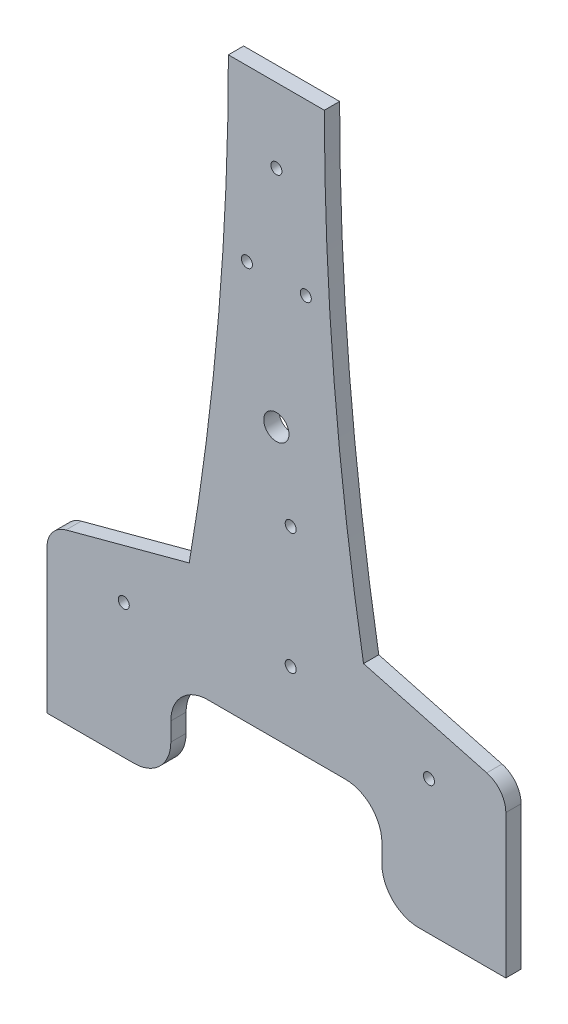
from build123d import *

# Parameters (mm, degrees)
ESBO_O2_R                = 1.5
ESBO_O2_R_2              = 3.425
RESSALTO_EXTRUS_O1_DEPTH = 4.15


with BuildPart() as part:
    # Esboço2 → Ressalto-extrusão1 (new body)
    with BuildSketch(Plane.XY):
        with BuildLine():
            Line((0, 0), (23.7, 0))
            ThreePointArc((23.7, 0), (30.771067812, 2.928932188), (33.7, 10))
            Line((33.7, 10), (33.7, 15))
            ThreePointArc((33.7, 15), (36.628932188, 22.071067812), (43.7, 25))
            Line((43.7, 25), (81.1, 25))
            ThreePointArc((81.1, 25), (88.171067812, 22.071067812), (91.1, 15))
            Line((91.1, 15), (91.1, 10))
            ThreePointArc((91.1, 10), (94.028932188, 2.928932188), (101.1, 0))
            Line((101.1, 0), (124.8, 0))
            Line((124.8, 0), (124.8, 38.959077337))
            ThreePointArc((124.8, 38.959077337), (123.353473382, 43.22040734), (119.611733316, 45.720558121))
            Line((119.611733316, 45.720558121), (86.1, 54.7))
            ThreePointArc((86.1, 54.7), (78.117314341, 116.973565182), (75.45, 179.7))
            Line((75.45, 179.7), (49.35, 179.7))
            ThreePointArc((49.35, 179.7), (46.682685659, 116.973565182), (38.7, 54.7))
            Line((38.7, 54.7), (5.188266684, 45.720558121))
            ThreePointArc((5.188266684, 45.720558121), (1.446526618, 43.22040734), (0, 38.959077337))
            Line((0, 38.959077337), (0, 0))
        make_face()
        with Locations(Location((62.4, 159.5, 0), (0, 0, 180))):
            Circle(ESBO_O2_R, mode=Mode.SUBTRACT)
        with Locations(Location((54.4, 133.5, 0), (0, 0, 180))):
            Circle(ESBO_O2_R, mode=Mode.SUBTRACT)
        with Locations(Location((70.4, 133.5, 0), (0, 0, 180))):
            Circle(ESBO_O2_R, mode=Mode.SUBTRACT)
        with Locations(Location((62.4, 98.575, 0), (0, 0, 180))):
            Circle(ESBO_O2_R_2, mode=Mode.SUBTRACT)
        with Locations(Location((66.3, 77.1, 0), (0, 0, 180))):
            Circle(ESBO_O2_R, mode=Mode.SUBTRACT)
        with Locations(Location((66.3, 44.1, 0), (0, 0, 180))):
            Circle(ESBO_O2_R, mode=Mode.SUBTRACT)
        with Locations(Location((103.9, 36.5, 0), (0, 0, 180))):
            Circle(ESBO_O2_R, mode=Mode.SUBTRACT)
        with Locations(Location((20.9, 36.5, 0), (0, 0, 180))):
            Circle(ESBO_O2_R, mode=Mode.SUBTRACT)
    extrude(amount=RESSALTO_EXTRUS_O1_DEPTH)


solid = part.part
